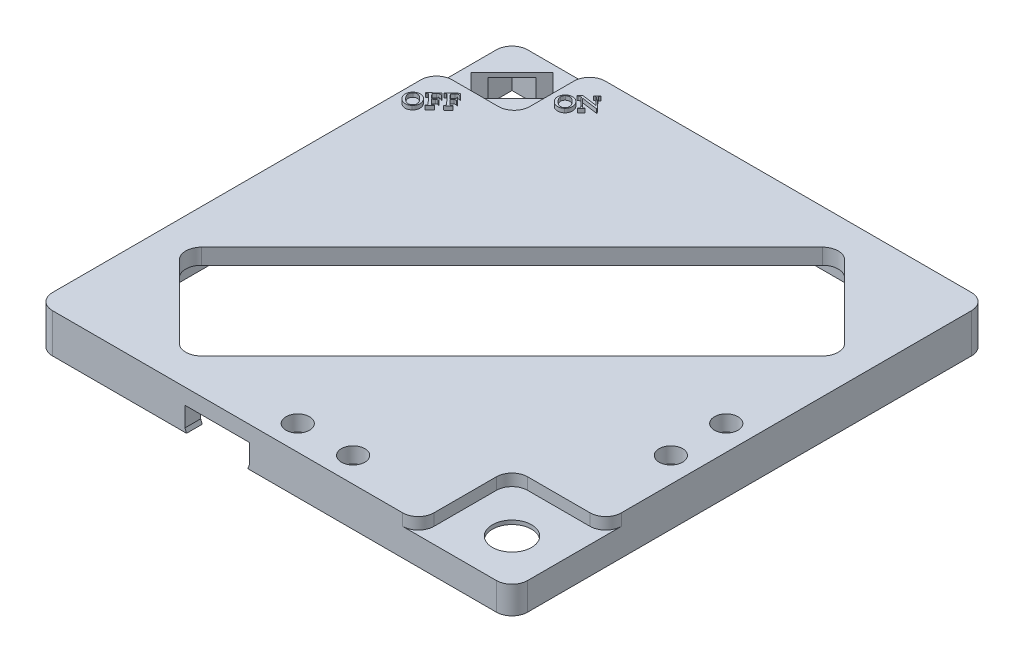
from build123d import *

# Parameters (mm, degrees)
SKETCH3_W           = 60.6
SKETCH3_H           = 60.6
BOSS_EXTRUDE1_DEPTH = 5
CUT_EXTRUDE1_DEPTH  = 44.141395434
SKETCH7_W           = 56.6
SKETCH7_H           = 56.6
CUT_EXTRUDE11_DEPTH = 3
SKETCH9_R           = 1.5
CUT_EXTRUDE12_DEPTH = 43.95555843
SKETCH12_R          = 2.75
CUT_EXTRUDE14_DEPTH = 4.5
SKETCH17_W          = 11.948549902
SKETCH17_H          = 11.948549902
SKETCH17_W_2        = 9.899494937
SKETCH17_H_2        = 9.626613423
CUT_EXTRUDE15_DEPTH = 43.95555843
CUT_EXTRUDE16_REACH = 69.937
SKETCH21_W          = 11.948549902
SKETCH21_H          = 11.948549902
SKETCH21_W_2        = 9.901163731
SKETCH21_H_2        = 9.901163731
BOSS_EXTRUDE2_DEPTH = 0.5
SKETCH22_R          = 2.501188887
CUT_EXTRUDE17_DEPTH = 43.993371582
FILLET3_R           = 2
BOSS_EXTRUDE3_DEPTH = 0.5


with BuildPart() as part:
    # Sketch3 → Boss-Extrude1 (new body)
    with BuildSketch(Plane(origin=(0, 0, 0), x_dir=(1, 0, 0), z_dir=(0, 1, 0))):
        Rectangle(SKETCH3_W, SKETCH3_H)
    extrude(amount=BOSS_EXTRUDE1_DEPTH)

    # Sketch4 → Cut-Extrude1 (cut, through all)
    with BuildSketch(Plane(origin=(0, 5, 0), x_dir=(1, 0, 0), z_dir=(0, 1, 0))):
        Polygon((-15.202795796, -27.223611076), (27.223611076, 15.202795796), (15.202795796, 27.223611076), (-27.223611076, -15.202795796), align=None)
    extrude(amount=-CUT_EXTRUDE1_DEPTH, mode=Mode.SUBTRACT)

    # Sketch7 → Cut-Extrude11 (cut)
    with BuildSketch(Plane.XZ):
        Rectangle(SKETCH7_W, SKETCH7_H)
    extrude(amount=-CUT_EXTRUDE11_DEPTH, mode=Mode.SUBTRACT)

    # Sketch9 → Cut-Extrude12 (cut, through all)
    with BuildSketch(Plane.XZ.offset(-3)):
        with Locations(Location((27.12, -0.2, 0), (0, 0, 270))):
            Circle(SKETCH9_R)
        with Locations(Location((27.12, 6.86, 0), (0, 0, 321.875088378))):
            Circle(SKETCH9_R)
        with Locations(Location((6.86, 27.12, 0), (0, 0, 270))):
            Circle(SKETCH9_R)
        with Locations(Location((-0.2, 27.12, 0), (0, 0, 51.875088378))):
            Circle(SKETCH9_R)
    extrude(amount=-CUT_EXTRUDE12_DEPTH, mode=Mode.SUBTRACT)

    # Sketch12 → Cut-Extrude14 (cut)
    with BuildSketch(Plane.XZ):
        with Locations(Location((-21.6, -9.72, 0), (0, 0, 270))):
            Circle(SKETCH12_R)
    extrude(amount=-CUT_EXTRUDE14_DEPTH, mode=Mode.SUBTRACT)

    # Sketch17 → Cut-Extrude15 (cut, through all)
    with BuildSketch(Plane.XZ.offset(-3)):
        with Locations((24.325725049, 24.325725049)):
            Rectangle(SKETCH17_W, SKETCH17_H)
        with Locations((-25.350252532, -25.486693288)):
            Rectangle(SKETCH17_W_2, SKETCH17_H_2)
    extrude(amount=-CUT_EXTRUDE15_DEPTH, mode=Mode.SUBTRACT)

    # Sketch20 → Cut-Extrude16 (cut, up to next)
    with BuildSketch(Plane.XY.offset(30.3), mode=Mode.PRIVATE) as cut_extrude16_sk1:
        Polygon((-11.2, 0), (-3.4, 0), (-3.2, 0.5), (-3.2, 3), (-11.4, 3), (-11.4, 0.5), align=None)
    cut_extrude16_tool1 = extrude(cut_extrude16_sk1.sketch, amount=-CUT_EXTRUDE16_REACH, mode=Mode.PRIVATE) & part.part
    add(cut_extrude16_tool1.solids().sort_by_distance((-7.3, 1.505442, 30.3))[0], mode=Mode.SUBTRACT)

    # Sketch21 → Boss-Extrude2 (add)
    with BuildSketch(Plane.XZ.offset(-3)):
        with Locations((24.325725049, 24.325725049)):
            Rectangle(SKETCH21_W, SKETCH21_H)
        with Locations((-25.349418134, -25.349418134)):
            Rectangle(SKETCH21_W_2, SKETCH21_H_2)
    extrude(amount=-BOSS_EXTRUDE2_DEPTH)

    # Sketch22 → Cut-Extrude17 (cut, through all)
    with BuildSketch(Plane(origin=(0, 3.5, 0), x_dir=(1, 0, 0), z_dir=(0, 1, 0))):
        with Locations(Location((24.395658377, -24.395658377, 0), (0, 0, 270))):
            Circle(SKETCH22_R)
        Polygon((-29.387324678, 24.154734498), (-24.154734498, 29.387324678), (-21.313180385, 26.545770566), (-26.545770566, 21.313180385), align=None)
    extrude(amount=-CUT_EXTRUDE17_DEPTH, mode=Mode.SUBTRACT)

    # Fillet3
    fillet3_edges = [part.edges().sort_by_distance(p)[0] for p in [
        (30.3, 4.25, 18.351450098),
        (-20.400505063, 4.25, -20.673386577),
        (-20.400505063, 4.25, -30.3),
        (-30.3, 4.25, -20.673386577),
        (27.223611076, 4, -15.202795796),
        (-15.202795796, 4, 27.223611076),
        (15.202795796, 4, -27.223611076),
        (-27.223611076, 4, 15.202795796),
        (-30.3, 2.5, 30.3),
        (30.3, 2.5, -30.3),
        (30.3, 1.75, 30.3),
        (-30.3, 1.75, -30.3),
        (18.351450098, 4.25, 18.351450098),
        (18.351450098, 4.25, 30.3),
    ]]
    fillet(fillet3_edges, radius=FILLET3_R)

    # Sketch23 → Boss-Extrude3 (add)
    # profile 1 of 5: a face of its own
    with BuildSketch(Plane(origin=(0, 5, 0), x_dir=(1, 0, 0), z_dir=(0, 1, 0))):
        with BuildLine():
            add(Edge.make_bspline(
                [(-28.928166109, 16.336743794), (-28.90425209, 16.357770232), (-28.857057118, 16.399266485), (-28.780047259, 16.452608299), (-28.698949192, 16.496361735), (-28.614277535, 16.532253126), (-28.525203705, 16.557313812), (-28.432600763, 16.57512427), (-28.336023829, 16.583074914), (-28.236807623, 16.582137365), (-28.137265034, 16.572308848), (-28.039641201, 16.553339072), (-27.945369382, 16.52456065), (-27.85473629, 16.486065139), (-27.767333835, 16.438433966), (-27.683393074, 16.381243068), (-27.602667989, 16.314739932), (-27.553159202, 16.264295722), (-27.527992498, 16.238653516)],
                knots=[0, 0, 0, 0, 0.978100523, 1.930308204, 2.871415458, 3.806198986, 4.750452221, 5.709734688, 6.70045807, 7.723183159, 8.755394787, 9.770435649, 10.774706439, 11.778937853, 12.791726501, 13.828906225, 14.896372188, 16, 16, 16, 16], degree=3))
            add(Edge.make_bspline(
                [(-27.527992498, 16.238653516), (-27.503357018, 16.210979803), (-27.455024886, 16.156686988), (-27.391744108, 16.069802536), (-27.338483515, 15.980167106), (-27.295316722, 15.887639125), (-27.261668116, 15.792776487), (-27.237975792, 15.695199936), (-27.224708119, 15.594963684), (-27.22085918, 15.493244233), (-27.226369281, 15.392534929), (-27.241112606, 15.294980193), (-27.264958517, 15.201708281), (-27.298107243, 15.112660857), (-27.340487566, 15.027751645), (-27.392414632, 14.947511006), (-27.45301805, 14.8711054), (-27.499573538, 14.825002392), (-27.523218192, 14.801587544)],
                knots=[0, 0, 0, 0, 1.109186392, 2.176102999, 3.213521787, 4.227370719, 5.229184635, 6.223397968, 7.229027976, 8.252388343, 9.26790266, 10.245355713, 11.202779809, 12.14608785, 13.085936137, 14.039085317, 15.004088446, 16, 16, 16, 16], degree=3))
            add(Edge.make_bspline(
                [(-27.523218192, 14.801587544), (-27.548394262, 14.779204121), (-27.597886866, 14.735201464), (-27.67852688, 14.679307871), (-27.761553246, 14.631666515), (-27.848693897, 14.594862158), (-27.938736104, 14.566661045), (-28.032275243, 14.54916268), (-28.12878106, 14.540317975), (-28.227464497, 14.541458298), (-28.326608496, 14.551341704), (-28.423698963, 14.572779109), (-28.518647854, 14.602436529), (-28.610314106, 14.643329627), (-28.699646002, 14.693414858), (-28.78530578, 14.754427719), (-28.86960695, 14.823812834), (-28.921273154, 14.87687827), (-28.947697359, 14.9040181)],
                knots=[0, 0, 0, 0, 1.01074184, 1.986976042, 2.940204119, 3.880284005, 4.821557656, 5.768149732, 6.732166665, 7.727052563, 8.727349191, 9.718319548, 10.707545748, 11.709284698, 12.726642952, 13.777616877, 14.863382598, 16, 16, 16, 16], degree=3))
            add(Edge.make_bspline(
                [(-28.947697359, 14.9040181), (-28.973450481, 14.932913432), (-29.023871079, 14.989485986), (-29.088364138, 15.080900539), (-29.141755624, 15.175116617), (-29.1841363, 15.272425469), (-29.215657767, 15.372641804), (-29.235628893, 15.475845192), (-29.244677936, 15.581842558), (-29.241724477, 15.653144953), (-29.240232081, 15.68917435)],
                knots=[0, 0, 0, 0, 1.075361515, 2.105390131, 3.103149409, 4.081242847, 5.050580957, 6.017646759, 6.998308666, 8, 8, 8, 8], degree=3))
            add(Edge.make_bspline(
                [(-29.240232081, 15.68917435), (-29.237191433, 15.720360268), (-29.231180791, 15.782007443), (-29.212196032, 15.872280832), (-29.185295819, 15.959098637), (-29.149953337, 16.042185983), (-29.106772311, 16.121789256), (-29.055109186, 16.197370723), (-28.996095071, 16.270106855), (-28.951041198, 16.314303794), (-28.928166109, 16.336743794)],
                knots=[0, 0, 0, 0, 1.020309451, 2.016910081, 2.999442779, 3.977407827, 4.954042781, 5.945076078, 6.9566587, 8, 8, 8, 8], degree=3))
        make_face()
        with BuildLine():
            add(Edge.make_bspline(
                [(-28.875648748, 16.239521572), (-28.89117492, 16.224206604), (-28.921446697, 16.194346616), (-28.960439581, 16.145112584), (-28.992854418, 16.093638962), (-29.01855805, 16.039757514), (-29.03746124, 15.983488459), (-29.049497254, 15.925066114), (-29.055429462, 15.864340085), (-29.053928336, 15.82329636), (-29.053166109, 15.8024556)],
                knots=[0, 0, 0, 0, 1.070344277, 2.086877761, 3.076607634, 4.052388088, 5.011887869, 5.984636453, 6.976659435, 8, 8, 8, 8], degree=3))
            add(Edge.make_bspline(
                [(-29.053166109, 15.8024556), (-29.050520627, 15.775721269), (-29.045141613, 15.721362794), (-29.023943223, 15.640259212), (-28.99508338, 15.55800455), (-28.955754562, 15.475128179), (-28.907477037, 15.391457738), (-28.849626373, 15.306829426), (-28.782341261, 15.22139953), (-28.73218461, 15.166019357), (-28.706377915, 15.137525044)],
                knots=[0, 0, 0, 0, 0.842396573, 1.71283108, 2.623790674, 3.576942379, 4.588385667, 5.654368427, 6.793121156, 8, 8, 8, 8], degree=3))
            add(Edge.make_bspline(
                [(-28.706377915, 15.137525044), (-28.678916455, 15.109140444), (-28.625594835, 15.054026374), (-28.542603089, 14.978875896), (-28.458953847, 14.914294684), (-28.376137602, 14.857888622), (-28.292427885, 14.812437025), (-28.209368044, 14.775404988), (-28.126005385, 14.74823886), (-28.069658479, 14.738039225), (-28.041881387, 14.733011155)],
                knots=[0, 0, 0, 0, 1.195908732, 2.322083053, 3.386924642, 4.394329449, 5.353150995, 6.267367695, 7.145871669, 8, 8, 8, 8], degree=3))
            add(Edge.make_bspline(
                [(-28.041881387, 14.733011155), (-28.021075666, 14.730665264), (-27.980265917, 14.726063874), (-27.919548656, 14.727195996), (-27.860603676, 14.73428545), (-27.803710606, 14.749331119), (-27.748635533, 14.770675816), (-27.695668658, 14.798838373), (-27.644452363, 14.833663154), (-27.613055327, 14.861549035), (-27.597002915, 14.875806294)],
                knots=[0, 0, 0, 0, 1.036364037, 2.032794507, 3.000981362, 3.971076708, 4.940112245, 5.921266466, 6.9372026, 8, 8, 8, 8], degree=3))
            add(Edge.make_bspline(
                [(-27.597002915, 14.875806294), (-27.580722675, 14.891965107), (-27.548777116, 14.923672398), (-27.507767726, 14.976294005), (-27.47352307, 15.031683819), (-27.446704751, 15.090255029), (-27.425804304, 15.151364173), (-27.413115614, 15.215744785), (-27.406561584, 15.282759193), (-27.406929925, 15.352614423), (-27.415508422, 15.42497184), (-27.43429851, 15.49929091), (-27.462220065, 15.575580562), (-27.500631865, 15.653211264), (-27.547606177, 15.733087466), (-27.605174323, 15.813972304), (-27.670955302, 15.897791646), (-27.720608026, 15.951943665), (-27.74630847, 15.979972961)],
                knots=[0, 0, 0, 0, 0.87520199, 1.717346704, 2.540744408, 3.356451598, 4.17232715, 5.001192804, 5.856017749, 6.739981606, 7.663708438, 8.631140434, 9.66058308, 10.760116578, 11.934065898, 13.195457414, 14.548357816, 16, 16, 16, 16], degree=3))
            add(Edge.make_bspline(
                [(-27.74630847, 15.979972961), (-27.774906466, 16.009683707), (-27.830216281, 16.06714563), (-27.916084824, 16.145074128), (-28.000727878, 16.213143555), (-28.084497994, 16.27125118), (-28.167588678, 16.319067034), (-28.250054772, 16.35608362), (-28.331327714, 16.384049747), (-28.386193014, 16.39396816), (-28.412975137, 16.398809766)],
                knots=[0, 0, 0, 0, 1.234112276, 2.386828799, 3.468285477, 4.483339165, 5.435706996, 6.33316462, 7.186345663, 8, 8, 8, 8], degree=3))
            add(Edge.make_bspline(
                [(-28.412975137, 16.398809766), (-28.433926891, 16.401029134), (-28.475335119, 16.405415406), (-28.537301487, 16.403519194), (-28.597809339, 16.394425896), (-28.656710585, 16.37759913), (-28.714402425, 16.354210251), (-28.77010583, 16.32277909), (-28.82487904, 16.285158856), (-28.858464996, 16.25496818), (-28.875648748, 16.239521572)],
                knots=[0, 0, 0, 0, 0.996352815, 1.969152815, 2.925054409, 3.885458765, 4.862107642, 5.864466878, 6.907386425, 8, 8, 8, 8], degree=3))
        make_face(mode=Mode.SUBTRACT)
    # profile 2 of 5: a face of its own
    with BuildSketch(Plane(origin=(0, 5, 0), x_dir=(1, 0, 0), z_dir=(0, 1, 0))):
        with BuildLine():
            Line((-27.595257936, 17.374468281), (-27.060535714, 16.803287725))
            Line((-27.060535714, 16.803287725), (-26.795778769, 17.050683559))
            add(Edge.make_bspline(
                [(-26.795778769, 17.050683559), (-26.781850023, 17.064443909), (-26.755851912, 17.090127707), (-26.72617993, 17.132497536), (-26.706517693, 17.173752723), (-26.699116557, 17.208956535), (-26.699903851, 17.237151194), (-26.703351987, 17.259806319), (-26.71067497, 17.283835838), (-26.720752445, 17.309484776), (-26.733835927, 17.336962133), (-26.750433757, 17.365829917), (-26.770049327, 17.396459055), (-26.784954259, 17.416795789), (-26.792740575, 17.42741967)],
                knots=[0, 0, 0, 0, 1.635053378, 3.051839611, 4.302824522, 5.437338451, 6.018370748, 6.655089809, 7.348304764, 8.114672115, 8.959143028, 9.891327754, 10.898432626, 12, 12, 12, 12], degree=3))
            Line((-26.792740575, 17.42741967), (-26.752810019, 17.464746059))
            Line((-26.752810019, 17.464746059), (-26.292740575, 16.972992587))
            Line((-26.292740575, 16.972992587), (-26.332671131, 16.935666198))
            add(Edge.make_bspline(
                [(-26.332671131, 16.935666198), (-26.34536338, 16.948445297), (-26.368984579, 16.972228128), (-26.404697306, 17.002699248), (-26.437865329, 17.025256697), (-26.469335518, 17.039981331), (-26.499142386, 17.047554361), (-26.527982441, 17.052045934), (-26.556572429, 17.050912641), (-26.5854219, 17.045759267), (-26.61485865, 17.034250306), (-26.645913189, 17.016328043), (-26.679199484, 16.991984099), (-26.70091743, 16.972206123), (-26.712445436, 16.961707864)],
                knots=[0, 0, 0, 0, 1.461234096, 2.7194628, 3.803810603, 4.707463434, 5.521983935, 6.292410237, 7.067652308, 7.832151476, 8.660765653, 9.617542877, 10.735378622, 12, 12, 12, 12], degree=3))
            Line((-26.712445436, 16.961707864), (-26.977202381, 16.714312031))
            Line((-26.977202381, 16.714312031), (-26.550553075, 16.258148837))
            add(Edge.make_bspline(
                [(-26.550553075, 16.258148837), (-26.542187007, 16.24929959), (-26.526300568, 16.232495638), (-26.503135368, 16.208777305), (-26.481637213, 16.187999672), (-26.461585522, 16.17029749), (-26.443757537, 16.15496996), (-26.427819724, 16.142108769), (-26.413123844, 16.132633157), (-26.403735336, 16.127600534), (-26.399511408, 16.125336337)],
                knots=[0, 0, 0, 0, 1.447185851, 2.748080496, 3.939750149, 4.999186033, 5.92602052, 6.734279461, 7.43054725, 8, 8, 8, 8], degree=3))
            add(Edge.make_bspline(
                [(-26.399511408, 16.125336337), (-26.393361981, 16.122911756), (-26.380528909, 16.117851965), (-26.359220654, 16.115166219), (-26.335904815, 16.11606115), (-26.320190047, 16.119566844), (-26.311837797, 16.121430087)],
                knots=[0, 0, 0, 0, 0.883818719, 1.844417125, 2.854328234, 4, 4, 4, 4], degree=3))
            add(Edge.make_bspline(
                [(-26.311837797, 16.121430087), (-26.300136935, 16.124704097), (-26.277193913, 16.131123769), (-26.245266733, 16.146543792), (-26.215253869, 16.164455431), (-26.197769524, 16.179742033), (-26.189007936, 16.187402309)],
                knots=[0, 0, 0, 0, 1.033001334, 2.025506346, 3.010560648, 4, 4, 4, 4], degree=3))
            Line((-26.189007936, 16.187402309), (-26.136490575, 16.236881475))
            Line((-26.136490575, 16.236881475), (-26.099598214, 16.197384948))
            Line((-26.099598214, 16.197384948), (-26.723296131, 15.613617587))
            Line((-26.723296131, 15.613617587), (-26.760188492, 15.653114114))
            Line((-26.760188492, 15.653114114), (-26.708539186, 15.701291198))
            add(Edge.make_bspline(
                [(-26.708539186, 15.701291198), (-26.695118398, 15.715014063), (-26.669769275, 15.740933748), (-26.641978069, 15.784774942), (-26.626648149, 15.830489113), (-26.626844595, 15.861054624), (-26.626941964, 15.876204392)],
                knots=[0, 0, 0, 0, 1.150870878, 2.173759583, 3.094825606, 4, 4, 4, 4], degree=3))
            add(Edge.make_bspline(
                [(-26.626941964, 15.876204392), (-26.627954965, 15.88145086), (-26.630202538, 15.893091337), (-26.637385425, 15.91125649), (-26.648721925, 15.931276494), (-26.662980268, 15.953796831), (-26.681034026, 15.978654595), (-26.70257445, 16.005763215), (-26.728055221, 16.035029), (-26.746529777, 16.054933298), (-26.756282242, 16.065440503)],
                knots=[0, 0, 0, 0, 0.552366717, 1.225550635, 2.009724863, 2.932188954, 3.98386385, 5.188557506, 6.515878141, 8, 8, 8, 8], degree=3))
            Line((-26.756282242, 16.065440503), (-27.634320436, 17.003808559))
            add(Edge.make_bspline(
                [(-27.634320436, 17.003808559), (-27.642510268, 17.012544185), (-27.658257459, 17.029340816), (-27.681692534, 17.052503725), (-27.702970589, 17.073474934), (-27.722366641, 17.091892348), (-27.740466981, 17.106960721), (-27.756851262, 17.119164434), (-27.770818047, 17.129488118), (-27.780239532, 17.134402047), (-27.784494047, 17.136621059)],
                knots=[0, 0, 0, 0, 1.427822853, 2.745380128, 3.928804638, 4.990801047, 5.934044291, 6.734583781, 7.428568655, 8, 8, 8, 8], degree=3))
            add(Edge.make_bspline(
                [(-27.784494047, 17.136621059), (-27.790777575, 17.139229083), (-27.803571301, 17.144539212), (-27.82492553, 17.147110382), (-27.84792634, 17.146859606), (-27.863520605, 17.143564713), (-27.871733631, 17.141829392)],
                knots=[0, 0, 0, 0, 0.91261741, 1.858156392, 2.871955978, 4, 4, 4, 4], degree=3))
            add(Edge.make_bspline(
                [(-27.871733631, 17.141829392), (-27.883128174, 17.138512603), (-27.905725427, 17.131934865), (-27.937577464, 17.116804452), (-27.967500544, 17.098205456), (-27.985208254, 17.082767043), (-27.994129464, 17.074989114)],
                knots=[0, 0, 0, 0, 1.009404637, 2.001815227, 2.993307201, 4, 4, 4, 4], degree=3))
            Line((-27.994129464, 17.074989114), (-28.045778769, 17.026812031))
            Line((-28.045778769, 17.026812031), (-28.083105158, 17.066742587))
            Line((-28.083105158, 17.066742587), (-27.001941964, 18.078461337))
            Line((-27.001941964, 18.078461337), (-26.688573908, 17.772471753))
            Line((-26.688573908, 17.772471753), (-26.726334325, 17.736881475))
            add(Edge.make_bspline(
                [(-26.726334325, 17.736881475), (-26.745860751, 17.748434015), (-26.782431868, 17.770070808), (-26.836114866, 17.79655526), (-26.884726295, 17.815239646), (-26.929244506, 17.826236419), (-26.970757608, 17.830156244), (-27.010590593, 17.828914907), (-27.049631483, 17.822410542), (-27.088798736, 17.809841933), (-27.129476083, 17.789154585), (-27.173984604, 17.75990616), (-27.223279168, 17.721061298), (-27.256630217, 17.690673772), (-27.274511408, 17.674381475)],
                knots=[0, 0, 0, 0, 1.32767869, 2.486614387, 3.499572555, 4.370461477, 5.161703177, 5.932747441, 6.697065723, 7.471034224, 8.330734595, 9.359568396, 10.584330509, 12, 12, 12, 12], degree=3))
            Line((-27.274511408, 17.674381475), (-27.595257936, 17.374468281))
        make_face()
    # profile 3 of 5: a face of its own
    with BuildSketch(Plane(origin=(0, 5, 0), x_dir=(1, 0, 0), z_dir=(0, 1, 0))):
        with BuildLine():
            Line((-26.378637867, 18.513596626), (-25.843915645, 17.94241607))
            Line((-25.843915645, 17.94241607), (-25.579158701, 18.189811904))
            add(Edge.make_bspline(
                [(-25.579158701, 18.189811904), (-25.565229954, 18.203572254), (-25.539231843, 18.229256052), (-25.509559862, 18.27162588), (-25.489897624, 18.312881068), (-25.482496488, 18.348084879), (-25.483283782, 18.376279539), (-25.486731918, 18.398934664), (-25.494054901, 18.422964183), (-25.504132376, 18.448613121), (-25.517215858, 18.476090477), (-25.533813688, 18.504958262), (-25.553429258, 18.535587399), (-25.568334191, 18.555924134), (-25.576120506, 18.566548015)],
                knots=[0, 0, 0, 0, 1.635053378, 3.051839611, 4.302824522, 5.437338451, 6.018370748, 6.655089809, 7.348304764, 8.114672115, 8.959143028, 9.891327754, 10.898432626, 12, 12, 12, 12], degree=3))
            Line((-25.576120506, 18.566548015), (-25.536189951, 18.603874404))
            Line((-25.536189951, 18.603874404), (-25.076120506, 18.112120931))
            Line((-25.076120506, 18.112120931), (-25.116051062, 18.074794542))
            add(Edge.make_bspline(
                [(-25.116051062, 18.074794542), (-25.128743311, 18.087573641), (-25.15236451, 18.111356473), (-25.188077237, 18.141827593), (-25.22124526, 18.164385041), (-25.25271545, 18.179109676), (-25.282522317, 18.186682705), (-25.311362372, 18.191174279), (-25.33995236, 18.190040985), (-25.368801831, 18.184887612), (-25.398238581, 18.173378651), (-25.42929312, 18.155456388), (-25.462579415, 18.131112444), (-25.484297361, 18.111334468), (-25.495825367, 18.100836209)],
                knots=[0, 0, 0, 0, 1.461234096, 2.7194628, 3.803810603, 4.707463434, 5.521983935, 6.292410237, 7.067652308, 7.832151476, 8.660765653, 9.617542877, 10.735378622, 12, 12, 12, 12], degree=3))
            Line((-25.495825367, 18.100836209), (-25.760582312, 17.853440376))
            Line((-25.760582312, 17.853440376), (-25.333933006, 17.397277181))
            add(Edge.make_bspline(
                [(-25.333933006, 17.397277181), (-25.325566938, 17.388427935), (-25.309680499, 17.371623983), (-25.286515299, 17.34790565), (-25.265017144, 17.327128017), (-25.244965453, 17.309425835), (-25.227137468, 17.294098305), (-25.211199655, 17.281237114), (-25.196503775, 17.271761501), (-25.187115267, 17.266728878), (-25.182891339, 17.264464681)],
                knots=[0, 0, 0, 0, 1.447185851, 2.748080496, 3.939750149, 4.999186033, 5.92602052, 6.734279461, 7.43054725, 8, 8, 8, 8], degree=3))
            add(Edge.make_bspline(
                [(-25.182891339, 17.264464681), (-25.176741912, 17.262040101), (-25.16390884, 17.25698031), (-25.142600585, 17.254294563), (-25.119284746, 17.255189495), (-25.103569978, 17.258695189), (-25.095217728, 17.260558431)],
                knots=[0, 0, 0, 0, 0.883818719, 1.844417125, 2.854328234, 4, 4, 4, 4], degree=3))
            add(Edge.make_bspline(
                [(-25.095217728, 17.260558431), (-25.083516866, 17.263832442), (-25.060573845, 17.270252114), (-25.028646664, 17.285672137), (-24.9986338, 17.303583775), (-24.981149455, 17.318870378), (-24.972387867, 17.326530654)],
                knots=[0, 0, 0, 0, 1.033001334, 2.025506346, 3.010560648, 4, 4, 4, 4], degree=3))
            Line((-24.972387867, 17.326530654), (-24.919870506, 17.37600982))
            Line((-24.919870506, 17.37600982), (-24.882978145, 17.336513292))
            Line((-24.882978145, 17.336513292), (-25.506676062, 16.752745931))
            Line((-25.506676062, 16.752745931), (-25.543568423, 16.792242459))
            Line((-25.543568423, 16.792242459), (-25.491919117, 16.840419542))
            add(Edge.make_bspline(
                [(-25.491919117, 16.840419542), (-25.478498329, 16.854142408), (-25.453149206, 16.880062092), (-25.425358, 16.923903287), (-25.41002808, 16.969617458), (-25.410224527, 17.000182969), (-25.410321895, 17.015332737)],
                knots=[0, 0, 0, 0, 1.150870878, 2.173759583, 3.094825606, 4, 4, 4, 4], degree=3))
            add(Edge.make_bspline(
                [(-25.410321895, 17.015332737), (-25.411334896, 17.020579205), (-25.413582469, 17.032219682), (-25.420765356, 17.050384835), (-25.432101856, 17.070404839), (-25.446360199, 17.092925176), (-25.464413957, 17.11778294), (-25.485954381, 17.14489156), (-25.511435152, 17.174157345), (-25.529909708, 17.194061643), (-25.539662173, 17.204568848)],
                knots=[0, 0, 0, 0, 0.552366717, 1.225550635, 2.009724863, 2.932188954, 3.98386385, 5.188557506, 6.515878141, 8, 8, 8, 8], degree=3))
            Line((-25.539662173, 17.204568848), (-26.417700367, 18.142936904))
            add(Edge.make_bspline(
                [(-26.417700367, 18.142936904), (-26.425890199, 18.151672529), (-26.441637391, 18.16846916), (-26.465072465, 18.191632069), (-26.48635052, 18.212603279), (-26.505746572, 18.231020693), (-26.523846912, 18.246089066), (-26.540231193, 18.258292778), (-26.554197978, 18.268616463), (-26.563619463, 18.273530392), (-26.567873978, 18.275749404)],
                knots=[0, 0, 0, 0, 1.427822853, 2.745380128, 3.928804638, 4.990801047, 5.934044291, 6.734583781, 7.428568655, 8, 8, 8, 8], degree=3))
            add(Edge.make_bspline(
                [(-26.567873978, 18.275749404), (-26.574157506, 18.278357428), (-26.586951232, 18.283667557), (-26.608305461, 18.286238727), (-26.631306271, 18.285987951), (-26.646900536, 18.282693057), (-26.655113562, 18.280957737)],
                knots=[0, 0, 0, 0, 0.91261741, 1.858156392, 2.871955978, 4, 4, 4, 4], degree=3))
            add(Edge.make_bspline(
                [(-26.655113562, 18.280957737), (-26.666508106, 18.277640948), (-26.689105358, 18.27106321), (-26.720957396, 18.255932797), (-26.750880475, 18.237333801), (-26.768588186, 18.221895388), (-26.777509395, 18.214117459)],
                knots=[0, 0, 0, 0, 1.009404637, 2.001815227, 2.993307201, 4, 4, 4, 4], degree=3))
            Line((-26.777509395, 18.214117459), (-26.829158701, 18.165940376))
            Line((-26.829158701, 18.165940376), (-26.866485089, 18.205870931))
            Line((-26.866485089, 18.205870931), (-25.785321895, 19.217589681))
            Line((-25.785321895, 19.217589681), (-25.471953839, 18.911600098))
            Line((-25.471953839, 18.911600098), (-25.509714256, 18.87600982))
            add(Edge.make_bspline(
                [(-25.509714256, 18.87600982), (-25.529240682, 18.887562359), (-25.565811799, 18.909199153), (-25.619494797, 18.935683605), (-25.668106226, 18.95436799), (-25.712624437, 18.965364764), (-25.75413754, 18.969284589), (-25.793970524, 18.968043252), (-25.833011414, 18.961538887), (-25.872178667, 18.948970278), (-25.912856014, 18.92828293), (-25.957364535, 18.899034505), (-26.006659099, 18.860189643), (-26.040010148, 18.829802117), (-26.057891339, 18.81350982)],
                knots=[0, 0, 0, 0, 1.32767869, 2.486614387, 3.499572555, 4.370461477, 5.161703177, 5.932747441, 6.697065723, 7.471034224, 8.330734595, 9.359568396, 10.584330509, 12, 12, 12, 12], degree=3))
            Line((-26.057891339, 18.81350982), (-26.378637867, 18.513596626))
        make_face()
    # profile 4 of 5: a face of its own
    with BuildSketch(Plane(origin=(0, 5, 0), x_dir=(1, 0, 0), z_dir=(0, 1, 0))):
        with BuildLine():
            add(Edge.make_bspline(
                [(-18.891050541, 25.734552638), (-18.867136522, 25.755579076), (-18.81994155, 25.797075329), (-18.742931691, 25.850417143), (-18.661833624, 25.894170579), (-18.577161966, 25.93006197), (-18.488088137, 25.955122656), (-18.395485195, 25.972933114), (-18.298908261, 25.980883758), (-18.199692055, 25.979946209), (-18.100149466, 25.970117692), (-18.002525633, 25.951147916), (-17.908253814, 25.922369494), (-17.817620722, 25.883873984), (-17.730218267, 25.836242811), (-17.646277506, 25.779051912), (-17.565552421, 25.712548776), (-17.516043634, 25.662104566), (-17.49087693, 25.63646236)],
                knots=[0, 0, 0, 0, 0.978100523, 1.930308204, 2.871415458, 3.806198986, 4.750452221, 5.709734688, 6.70045807, 7.723183159, 8.755394787, 9.770435649, 10.774706439, 11.778937853, 12.791726501, 13.828906225, 14.896372188, 16, 16, 16, 16], degree=3))
            add(Edge.make_bspline(
                [(-17.49087693, 25.63646236), (-17.466241449, 25.608788647), (-17.417909318, 25.554495832), (-17.35462854, 25.46761138), (-17.301367947, 25.37797595), (-17.258201154, 25.285447969), (-17.224552547, 25.190585331), (-17.200860224, 25.09300878), (-17.187592551, 24.992772528), (-17.183743612, 24.891053077), (-17.189253713, 24.790343773), (-17.203997038, 24.692789037), (-17.227842949, 24.599517125), (-17.260991675, 24.510469702), (-17.303371998, 24.425560489), (-17.355299064, 24.34531985), (-17.415902481, 24.268914244), (-17.46245797, 24.222811236), (-17.486102624, 24.199396388)],
                knots=[0, 0, 0, 0, 1.109186392, 2.176102999, 3.213521787, 4.227370719, 5.229184635, 6.223397968, 7.229027976, 8.252388343, 9.26790266, 10.245355713, 11.202779809, 12.14608785, 13.085936137, 14.039085317, 15.004088446, 16, 16, 16, 16], degree=3))
            add(Edge.make_bspline(
                [(-17.486102624, 24.199396388), (-17.511278693, 24.177012965), (-17.560771298, 24.133010308), (-17.641411311, 24.077116715), (-17.724437678, 24.029475359), (-17.811578329, 23.992671002), (-17.901620535, 23.964469889), (-17.995159675, 23.946971524), (-18.091665491, 23.938126819), (-18.190348929, 23.939267142), (-18.289492928, 23.949150548), (-18.386583395, 23.970587954), (-18.481532286, 24.000245373), (-18.573198538, 24.041138471), (-18.662530434, 24.091223702), (-18.748190212, 24.152236564), (-18.832491381, 24.221621678), (-18.884157586, 24.274687115), (-18.910581791, 24.301826944)],
                knots=[0, 0, 0, 0, 1.01074184, 1.986976042, 2.940204119, 3.880284005, 4.821557656, 5.768149732, 6.732166665, 7.727052563, 8.727349191, 9.718319548, 10.707545748, 11.709284698, 12.726642952, 13.777616877, 14.863382598, 16, 16, 16, 16], degree=3))
            add(Edge.make_bspline(
                [(-18.910581791, 24.301826944), (-18.936334913, 24.330722276), (-18.986755511, 24.387294831), (-19.051248569, 24.478709383), (-19.104640056, 24.572925461), (-19.147020731, 24.670234314), (-19.178542199, 24.770450648), (-19.198513325, 24.873654037), (-19.207562368, 24.979651403), (-19.204608908, 25.050953797), (-19.203116513, 25.086983194)],
                knots=[0, 0, 0, 0, 1.075361515, 2.105390131, 3.103149409, 4.081242847, 5.050580957, 6.017646759, 6.998308666, 8, 8, 8, 8], degree=3))
            add(Edge.make_bspline(
                [(-19.203116513, 25.086983194), (-19.200075865, 25.118169113), (-19.194065223, 25.179816287), (-19.175080464, 25.270089676), (-19.14818025, 25.356907481), (-19.112837769, 25.439994827), (-19.069656743, 25.5195981), (-19.017993618, 25.595179567), (-18.958979503, 25.667915699), (-18.913925629, 25.712112638), (-18.891050541, 25.734552638)],
                knots=[0, 0, 0, 0, 1.020309451, 2.016910081, 2.999442779, 3.977407827, 4.954042781, 5.945076078, 6.9566587, 8, 8, 8, 8], degree=3))
        make_face()
        with BuildLine():
            add(Edge.make_bspline(
                [(-18.83853318, 25.637330416), (-18.854059352, 25.622015448), (-18.884331128, 25.592155461), (-18.923324013, 25.542921428), (-18.955738849, 25.491447806), (-18.981442482, 25.437566358), (-19.000345672, 25.381297303), (-19.012381686, 25.322874958), (-19.018313894, 25.262148929), (-19.016812767, 25.221105204), (-19.016050541, 25.200264444)],
                knots=[0, 0, 0, 0, 1.070344277, 2.086877761, 3.076607634, 4.052388088, 5.011887869, 5.984636453, 6.976659435, 8, 8, 8, 8], degree=3))
            add(Edge.make_bspline(
                [(-19.016050541, 25.200264444), (-19.013405059, 25.173530113), (-19.008026045, 25.119171638), (-18.986827655, 25.038068056), (-18.957967812, 24.955813394), (-18.918638994, 24.872937024), (-18.870361469, 24.789266582), (-18.812510805, 24.70463827), (-18.745225693, 24.619208374), (-18.695069042, 24.563828201), (-18.669262346, 24.535333888)],
                knots=[0, 0, 0, 0, 0.842396573, 1.71283108, 2.623790674, 3.576942379, 4.588385667, 5.654368427, 6.793121156, 8, 8, 8, 8], degree=3))
            add(Edge.make_bspline(
                [(-18.669262346, 24.535333888), (-18.641800887, 24.506949288), (-18.588479267, 24.451835218), (-18.505487521, 24.37668474), (-18.421838278, 24.312103528), (-18.339022033, 24.255697466), (-18.255312317, 24.210245869), (-18.172252475, 24.173213832), (-18.088889816, 24.146047704), (-18.032542911, 24.135848069), (-18.004765819, 24.130819999)],
                knots=[0, 0, 0, 0, 1.195908732, 2.322083053, 3.386924642, 4.394329449, 5.353150995, 6.267367695, 7.145871669, 8, 8, 8, 8], degree=3))
            add(Edge.make_bspline(
                [(-18.004765819, 24.130819999), (-17.983960098, 24.128474108), (-17.943150349, 24.123872718), (-17.882433088, 24.12500484), (-17.823488107, 24.132094294), (-17.766595037, 24.147139963), (-17.711519965, 24.168484661), (-17.658553089, 24.196647217), (-17.607336795, 24.231471998), (-17.575939759, 24.259357879), (-17.559887346, 24.273615138)],
                knots=[0, 0, 0, 0, 1.036364037, 2.032794507, 3.000981362, 3.971076708, 4.940112245, 5.921266466, 6.9372026, 8, 8, 8, 8], degree=3))
            add(Edge.make_bspline(
                [(-17.559887346, 24.273615138), (-17.543607107, 24.289773951), (-17.511661548, 24.321481242), (-17.470652158, 24.374102849), (-17.436407502, 24.429492663), (-17.409589183, 24.488063873), (-17.388688735, 24.549173017), (-17.376000046, 24.613553629), (-17.369446016, 24.680568038), (-17.369814357, 24.750423267), (-17.378392854, 24.822780684), (-17.397182942, 24.897099754), (-17.425104497, 24.973389406), (-17.463516297, 25.051020108), (-17.510490609, 25.13089631), (-17.568058755, 25.211781148), (-17.633839734, 25.295600491), (-17.683492458, 25.349752509), (-17.709192902, 25.377781805)],
                knots=[0, 0, 0, 0, 0.87520199, 1.717346704, 2.540744408, 3.356451598, 4.17232715, 5.001192804, 5.856017749, 6.739981606, 7.663708438, 8.631140434, 9.66058308, 10.760116578, 11.934065898, 13.195457414, 14.548357816, 16, 16, 16, 16], degree=3))
            add(Edge.make_bspline(
                [(-17.709192902, 25.377781805), (-17.737790898, 25.407492551), (-17.793100713, 25.464954474), (-17.878969256, 25.542882973), (-17.96361231, 25.610952399), (-18.047382426, 25.669060024), (-18.13047311, 25.716875878), (-18.212939204, 25.753892464), (-18.294212146, 25.781858591), (-18.349077446, 25.791777004), (-18.375859569, 25.79661861)],
                knots=[0, 0, 0, 0, 1.234112276, 2.386828799, 3.468285477, 4.483339165, 5.435706996, 6.33316462, 7.186345663, 8, 8, 8, 8], degree=3))
            add(Edge.make_bspline(
                [(-18.375859569, 25.79661861), (-18.396811322, 25.798837978), (-18.438219551, 25.80322425), (-18.500185919, 25.801328038), (-18.56069377, 25.79223474), (-18.619595017, 25.775407974), (-18.677286857, 25.752019095), (-18.732990262, 25.720587934), (-18.787763472, 25.6829677), (-18.821349428, 25.652777024), (-18.83853318, 25.637330416)],
                knots=[0, 0, 0, 0, 0.996352815, 1.969152815, 2.925054409, 3.885458765, 4.862107642, 5.864466878, 6.907386425, 8, 8, 8, 8], degree=3))
        make_face(mode=Mode.SUBTRACT)
    # profile 5 of 5: a face of its own
    with BuildSketch(Plane(origin=(0, 5, 0), x_dir=(1, 0, 0), z_dir=(0, 1, 0))):
        with BuildLine():
            Line((-18.110225701, 26.40422157), (-17.715694451, 26.773579208))
            Line((-17.715694451, 26.773579208), (-15.80770834, 26.514898653))
            Line((-15.80770834, 26.514898653), (-16.591562507, 27.352572264))
            add(Edge.make_bspline(
                [(-16.591562507, 27.352572264), (-16.601611919, 27.363208868), (-16.620655729, 27.383365416), (-16.648990415, 27.410934363), (-16.675445717, 27.434276202), (-16.699587134, 27.454153124), (-16.722229329, 27.46938003), (-16.742632132, 27.480804109), (-16.761038381, 27.48887202), (-16.773073933, 27.490940536), (-16.778628479, 27.491895181)],
                knots=[0, 0, 0, 0, 1.483230272, 2.810746905, 4.005499274, 5.059058418, 5.978307079, 6.766014433, 7.430501398, 8, 8, 8, 8], degree=3))
            add(Edge.make_bspline(
                [(-16.778628479, 27.491895181), (-16.792321593, 27.492040443), (-16.820610098, 27.492340541), (-16.863173664, 27.478248124), (-16.906111566, 27.454347172), (-16.931961418, 27.431552887), (-16.945729173, 27.419412542)],
                knots=[0, 0, 0, 0, 0.871370642, 1.800158322, 2.828353789, 4, 4, 4, 4], degree=3))
            Line((-16.945729173, 27.419412542), (-16.996076396, 27.372103514))
            Line((-16.996076396, 27.372103514), (-17.033402785, 27.41203407))
            Line((-17.033402785, 27.41203407), (-16.527326396, 27.885558375))
            Line((-16.527326396, 27.885558375), (-16.490000007, 27.84562782))
            Line((-16.490000007, 27.84562782), (-16.541649312, 27.797450736))
            add(Edge.make_bspline(
                [(-16.541649312, 27.797450736), (-16.555497093, 27.783528488), (-16.581464975, 27.757420961), (-16.608177238, 27.712079449), (-16.623020605, 27.665672157), (-16.621139025, 27.634779683), (-16.62020834, 27.619499347)],
                knots=[0, 0, 0, 0, 1.161011364, 2.177172422, 3.098375311, 4, 4, 4, 4], degree=3))
            add(Edge.make_bspline(
                [(-16.62020834, 27.619499347), (-16.619048153, 27.61439191), (-16.616534647, 27.603326821), (-16.609135065, 27.586189415), (-16.598594378, 27.567073616), (-16.584518946, 27.545957977), (-16.567557743, 27.522410496), (-16.547182184, 27.496876605), (-16.523131916, 27.469642503), (-16.505947266, 27.45092158), (-16.496944451, 27.441113931)],
                knots=[0, 0, 0, 0, 0.572911384, 1.241193098, 2.035751238, 2.963533685, 4.019525564, 5.215362592, 6.541164616, 8, 8, 8, 8], degree=3))
            Line((-16.496944451, 27.441113931), (-15.351111118, 26.21672157))
            Line((-15.351111118, 26.21672157), (-15.38973959, 26.180263236))
            Line((-15.38973959, 26.180263236), (-17.442690979, 26.454134764))
            Line((-17.442690979, 26.454134764), (-16.605451396, 25.559169486))
            add(Edge.make_bspline(
                [(-16.605451396, 25.559169486), (-16.595361257, 25.548716597), (-16.576105359, 25.528768429), (-16.548161244, 25.500980189), (-16.522008214, 25.477279391), (-16.4977391, 25.457829158), (-16.475809721, 25.441853157), (-16.455463402, 25.430553586), (-16.437498424, 25.421995601), (-16.425539796, 25.419919267), (-16.420121535, 25.418978514)],
                knots=[0, 0, 0, 0, 1.479429333, 2.823325044, 4.012561858, 5.070949442, 5.990642714, 6.769101302, 7.442299669, 8, 8, 8, 8], degree=3))
            add(Edge.make_bspline(
                [(-16.420121535, 25.418978514), (-16.406119305, 25.418759371), (-16.377459786, 25.418310832), (-16.334917062, 25.433273416), (-16.291809875, 25.456293984), (-16.266189052, 25.478981954), (-16.252586812, 25.491027125)],
                knots=[0, 0, 0, 0, 0.889049664, 1.819691419, 2.842461899, 4, 4, 4, 4], degree=3))
            Line((-16.252586812, 25.491027125), (-16.200937507, 25.539638236))
            Line((-16.200937507, 25.539638236), (-16.164045146, 25.500141708))
            Line((-16.164045146, 25.500141708), (-16.669687507, 25.026617403))
            Line((-16.669687507, 25.026617403), (-16.706579868, 25.066113931))
            Line((-16.706579868, 25.066113931), (-16.656232646, 25.113422958))
            add(Edge.make_bspline(
                [(-16.656232646, 25.113422958), (-16.642274545, 25.127508813), (-16.616173989, 25.15384826), (-16.588690943, 25.199209194), (-16.573938912, 25.245957605), (-16.57615055, 25.276970999), (-16.57723959, 25.292242403)],
                knots=[0, 0, 0, 0, 1.165913306, 2.180166746, 3.103890141, 4, 4, 4, 4], degree=3))
            add(Edge.make_bspline(
                [(-16.57723959, 25.292242403), (-16.578416668, 25.297342617), (-16.580996957, 25.308522862), (-16.588151912, 25.325916059), (-16.599064242, 25.345024322), (-16.612122189, 25.366701591), (-16.629669626, 25.389763775), (-16.649801774, 25.415191013), (-16.673430119, 25.442676436), (-16.690604402, 25.461279505), (-16.699635423, 25.471061847)],
                knots=[0, 0, 0, 0, 0.573171155, 1.256455898, 2.051374308, 2.984442828, 4.028097173, 5.22447642, 6.540503149, 8, 8, 8, 8], degree=3))
            Line((-16.699635423, 25.471061847), (-17.644947923, 26.481478514))
            add(Edge.make_bspline(
                [(-17.644947923, 26.481478514), (-17.66547549, 26.48368091), (-17.703152326, 26.487723245), (-17.755011939, 26.490812378), (-17.797011961, 26.491498648), (-17.831706591, 26.489775826), (-17.862966513, 26.483192884), (-17.895616414, 26.474254391), (-17.931381707, 26.460305212), (-17.956055563, 26.449190283), (-17.969166673, 26.44328407)],
                knots=[0, 0, 0, 0, 1.489694949, 2.734225314, 3.746977689, 4.521313386, 5.233851665, 6.04698106, 6.96221137, 8, 8, 8, 8], degree=3))
            add(Edge.make_bspline(
                [(-17.969166673, 26.44328407), (-17.976504939, 26.439400954), (-17.992655677, 26.430854634), (-18.016692095, 26.412810145), (-18.044243023, 26.390737815), (-18.062882038, 26.373535926), (-18.072899312, 26.364291014)],
                knots=[0, 0, 0, 0, 0.760645241, 1.6740987, 2.749977284, 4, 4, 4, 4], degree=3))
            Line((-18.072899312, 26.364291014), (-18.110225701, 26.40422157))
        make_face()
    extrude(amount=BOSS_EXTRUDE3_DEPTH)


solid = part.part
